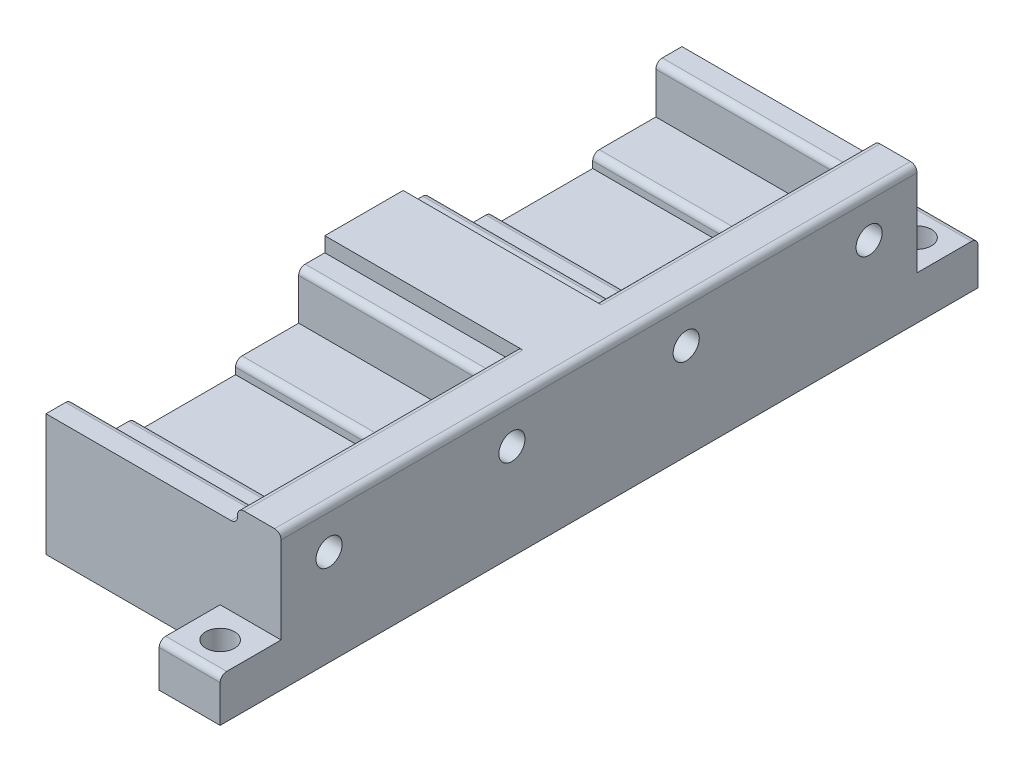
from build123d import *

# Parameters (mm, degrees)
BOSS_EXTRUDE1_DEPTH = 11
SKETCH3_W           = 22
SKETCH3_H           = 3
BOSS_EXTRUDE2_DEPTH = 14
BOSS_EXTRUDE3_DEPTH = 5
SKETCH5_R           = 1.5
CUT_EXTRUDE1_DEPTH  = 36.096650541
SKETCH6_W           = 7
SKETCH6_H           = 7
BOSS_EXTRUDE4_DEPTH = 5
SKETCH10_R          = 1.65
CUT_EXTRUDE2_DEPTH  = 33.123192233
SKETCH8_W           = 27
SKETCH8_H           = 15.7
BOSS_EXTRUDE5_DEPTH = 4.5
FILLET1_R           = 0.75


with BuildPart() as part:
    # Sketch1 → Boss-Extrude1 (new, symmetric)
    with BuildSketch(Plane(origin=(0, 0, 0), x_dir=(0, 0, -1), z_dir=(1, 0, 0))):
        Polygon((-13.0089, 0), (13.0089, 0), (13.0089, 8.5), (5.7589, 8.5), (5.7589, 7), (-5.7589, 7), (-5.7589, 8.5), (-13.0089, 8.5), align=None)
    extrude(amount=BOSS_EXTRUDE1_DEPTH, both=True)

    # Sketch3 → Boss-Extrude2 (add)
    with BuildSketch(Plane.XZ):
        with Locations((0, -14.5089)):
            Rectangle(SKETCH3_W, SKETCH3_H)
        with Locations((0, 14.5089)):
            Rectangle(SKETCH3_W, SKETCH3_H)
    extrude(amount=-BOSS_EXTRUDE2_DEPTH)

    # Sketch4 → Boss-Extrude3 (add)
    with BuildSketch(Plane(origin=(11, 0, 0), x_dir=(0, 0, -1), z_dir=(1, 0, 0))):
        Polygon((-8.8, 15.7), (-16.0089, 15.7), (-16.0089, 0), (16.0089, 0), (16.0089, 15.7), align=None)
    extrude(amount=BOSS_EXTRUDE3_DEPTH)

    # Sketch5 → Cut-Extrude1 (cut, through all)
    with BuildSketch(Plane(origin=(16, 0, 0), x_dir=(0, 0, -1), z_dir=(1, 0, 0))):
        with Locations((-10.5, 11)):
            Circle(SKETCH5_R)
        with Locations((10.5, 11)):
            Circle(SKETCH5_R)
    extrude(amount=-CUT_EXTRUDE1_DEPTH, mode=Mode.SUBTRACT)

    # Sketch6 → Boss-Extrude4 (add)
    with BuildSketch(Plane.XZ):
        with Locations((12.5, 19.5089)):
            Rectangle(SKETCH6_W, SKETCH6_H)
    extrude(amount=-BOSS_EXTRUDE4_DEPTH)

    # Sketch10 → Cut-Extrude2 (cut, through all)
    with BuildSketch(Plane.XZ):
        with Locations(Location((12.5, 19.5089, 0), (0, 0, 270))):
            Circle(SKETCH10_R)
    extrude(amount=-CUT_EXTRUDE2_DEPTH, mode=Mode.SUBTRACT)

    # Sketch8 → Boss-Extrude5 (add)
    with BuildSketch(Plane(origin=(0, 0, -16.0089), x_dir=(-1, 0, 0), z_dir=(0, 0, -1))):
        with Locations((-2.5, 7.85)):
            Rectangle(SKETCH8_W, SKETCH8_H)
    extrude(amount=BOSS_EXTRUDE5_DEPTH)

    # Fillet1
    fillet1_edges = [part.edges().sort_by_distance(p)[0] for p in [
        (0, 8.5, 5.7589),
        (0, 8.5, -5.7589),
        (0, 14, -13.0089),
        (11, 14, -14.5089),
        (11, 11.25, -13.0089),
        (11, 14, 14.5089),
        (11, 11.25, 13.0089),
        (0, 14, 13.0089),
        (11, 15.7, 0),
        (16, 15.7, -2.25),
        (12.5, 5, 23.0089),
    ]]
    fillet(fillet1_edges, radius=FILLET1_R)

    # Mirror6: part across plane


with BuildPart() as part_1:
    add(part.part)
    add(part.part.mirror(Plane(origin=(0, 0, -20.5089), x_dir=(1, 0, 0), z_dir=(0, 0, -1))))


solid = part_1.part
